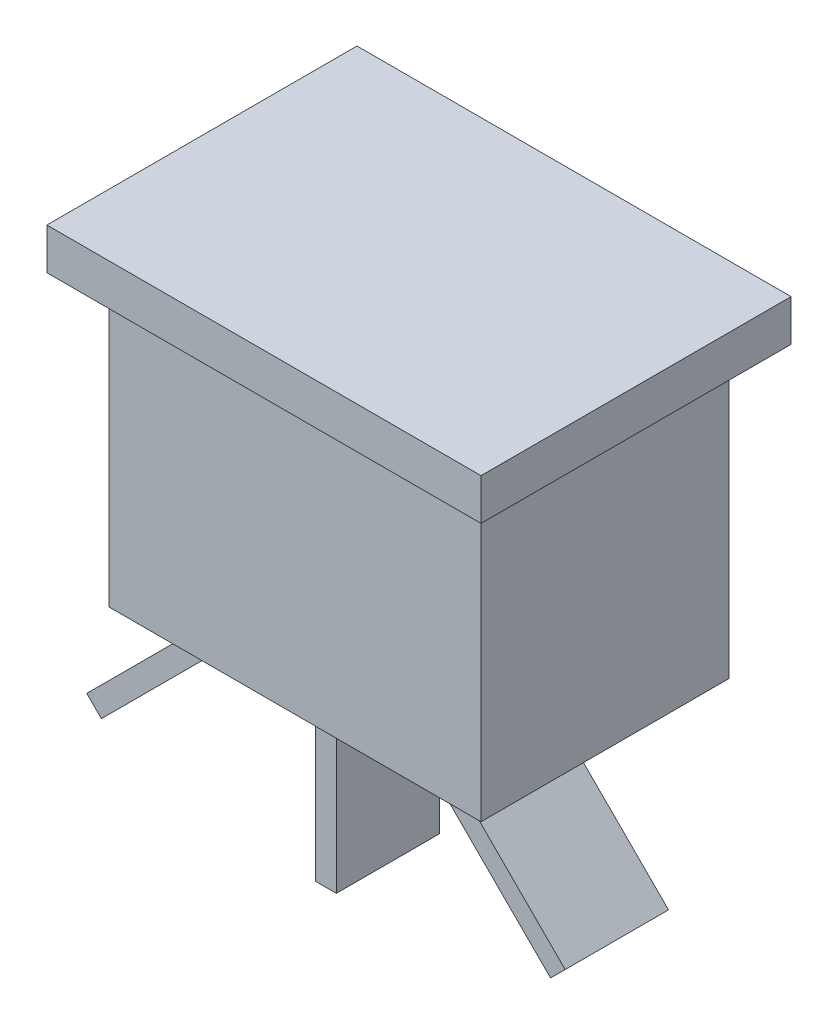
from build123d import *

# Parameters (mm, degrees)
SKETCH1_W                = 18
SKETCH1_H                = 12
BOSS_EXTRUDE1_DEPTH      = 14
SKETCH2_W                = 21
SKETCH2_H                = 15
BOSS_EXTRUDE2_DEPTH      = 2
BOSS_EXTRUDE3_DEPTH      = 2.5
BOSS_EXTRUDE3_DEPTH_BACK = 2.5
SKETCH3_W                = 1
SKETCH3_H                = 8


with BuildPart() as part:
    # Sketch1 → Boss-Extrude1 (new body)
    with BuildSketch(Plane(origin=(0, 0, 0), x_dir=(1, 0, 0), z_dir=(0, 1, 0))):
        with Locations((9, 2)):
            Rectangle(SKETCH1_W, SKETCH1_H)
    extrude(amount=BOSS_EXTRUDE1_DEPTH)

    # Sketch2 → Boss-Extrude2 (add)
    with BuildSketch(Plane(origin=(0, 14, 0), x_dir=(1, 0, 0), z_dir=(0, 1, 0))):
        with Locations((9, 2)):
            Rectangle(SKETCH2_W, SKETCH2_H)
    extrude(amount=BOSS_EXTRUDE2_DEPTH)

    # Sketch3 → Boss-Extrude3 (add, two sides: drawn at the far end of the back side and taken through both)
    with BuildSketch(Plane.XY.offset(-BOSS_EXTRUDE3_DEPTH_BACK)):
        with Locations((9, -4)):
            Rectangle(SKETCH3_W, SKETCH3_H)
        Polygon((13.5, 0), (19.863961031, -6.363961031), (20.571067812, -5.656854249), (14.914213562, 0), align=None)
        Polygon((3.085786438, 0), (4.5, 0), (-1.863961031, -6.363961031), (-2.571067812, -5.656854249), align=None)
    extrude(amount=BOSS_EXTRUDE3_DEPTH + BOSS_EXTRUDE3_DEPTH_BACK)


solid = part.part
